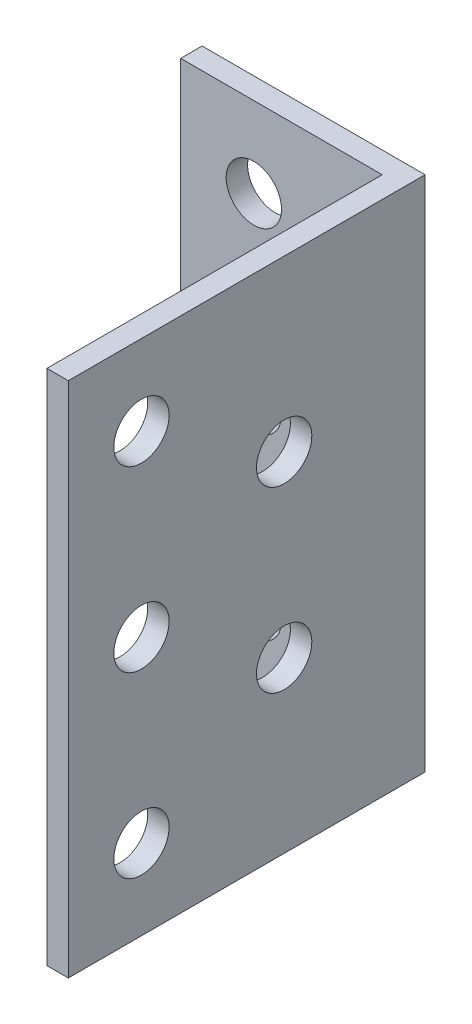
from build123d import *

# Parameters (mm, degrees)
SKETCH1_W      = 125
SKETCH1_H      = 290
SKETCH1_R      = 15.5
EXTRUDE1_DEPTH = 12
SKETCH2_W      = 12
SKETCH2_H      = 290
EXTRUDE2_DEPTH = 188
SKETCH3_R      = 15.5
EXTRUDE3_DEPTH = 188


with BuildPart() as part:
    # Sketch1 → Extrude1 (new body)
    with BuildSketch(Plane.XY):
        with Locations((62.5, 145)):
            Rectangle(SKETCH1_W, SKETCH1_H)
        with Locations((41, 45)):
            Circle(SKETCH1_R, mode=Mode.SUBTRACT)
        with Locations((41, 145)):
            Circle(SKETCH1_R, mode=Mode.SUBTRACT)
        with Locations((41, 245)):
            Circle(SKETCH1_R, mode=Mode.SUBTRACT)
    extrude(amount=EXTRUDE1_DEPTH)

    # Sketch2 → Extrude2 (add)
    with BuildSketch(Plane.XY.offset(12)):
        with Locations((119, 145)):
            Rectangle(SKETCH2_W, SKETCH2_H)
    extrude(amount=EXTRUDE2_DEPTH)

    # Sketch3 → Extrude3 (cut)
    with BuildSketch(Plane.ZY.offset(-113)):
        with Locations(Location((159, 45, 0), (0, 0, 270))):
            Circle(SKETCH3_R)
        with Locations(Location((159, 145, 0), (0, 0, 270))):
            Circle(SKETCH3_R)
        with Locations(Location((159, 245, 0), (0, 0, 270))):
            Circle(SKETCH3_R)
        with Locations(Location((79, 95, 0), (0, 0, 270))):
            Circle(SKETCH3_R)
        with Locations(Location((79, 195, 0), (0, 0, 270))):
            Circle(SKETCH3_R)
    extrude(amount=-EXTRUDE3_DEPTH, mode=Mode.SUBTRACT)


solid = part.part
